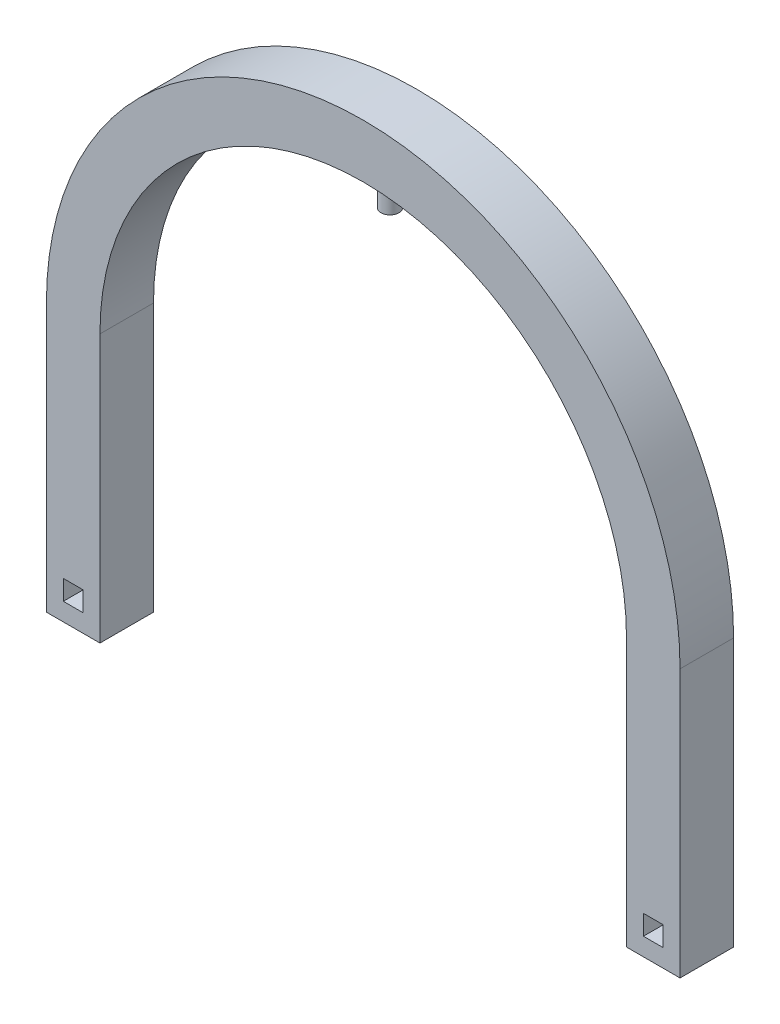
from build123d import *

# Parameters (mm, degrees)
SKETCH1_W                = 76.2
SKETCH1_H                = 76.2
BOSS_EXTRUDE1_DEPTH      = 381
BOSS_EXTRUDE1_2_DEPTH    = 381
CUT_EXTRUDE1_DEPTH       = 945.678553795
CUT_EXTRUDE1_DEPTH_BACK  = 945.678553795
SKETCH3_W                = 28.047256614
SKETCH3_H                = 28.245033948
BOSS_EXTRUDE2_DEPTH      = 38.1
BOSS_EXTRUDE2_DEPTH_BACK = 38.1
SKETCH5_R                = 12.7
BOSS_EXTRUDE3_DEPTH      = 50.8


with BuildPart() as part:
    # Sketch1 → Boss-Extrude1 (new body)
    with BuildSketch(Plane(origin=(0, 0, 0), x_dir=(1, 0, 0), z_dir=(0, 1, 0))):
        Rectangle(SKETCH1_W, SKETCH1_H)
    extrude(amount=BOSS_EXTRUDE1_DEPTH)


with BuildPart() as body_2:
    # Sketch1 → Boss-Extrude1 2 (new body)
    with BuildSketch(Plane(origin=(0, 0, 0), x_dir=(1, 0, 0), z_dir=(0, 1, 0))):
        with Locations((-825.5, 0)):
            Rectangle(SKETCH1_W, SKETCH1_H)
    extrude(amount=BOSS_EXTRUDE1_2_DEPTH)


with BuildPart() as cut_extrude1_tool:
    # Sketch3 → Cut-Extrude1 (new, two sides: drawn at the far end of the back side and taken through both)
    with BuildSketch(Plane.XY.offset(-CUT_EXTRUDE1_DEPTH_BACK)):
        with Locations((-825.5, 39.522516974)):
            Rectangle(SKETCH3_W, SKETCH3_H)
        with Locations((0, 39.522516974)):
            Rectangle(SKETCH3_W, SKETCH3_H)
    extrude(amount=CUT_EXTRUDE1_DEPTH + CUT_EXTRUDE1_DEPTH_BACK)


with BuildPart() as part_1:
    add(part.part)

    # Cut-Extrude1: cut by cut_extrude1_tool
    add(cut_extrude1_tool.part, mode=Mode.SUBTRACT)



with BuildPart() as body_2_1:
    add(body_2.part)

    # Cut-Extrude1: cut by cut_extrude1_tool
    add(cut_extrude1_tool.part, mode=Mode.SUBTRACT)


with BuildPart() as part_2:
    add(part_1.part)

    add(body_2_1.part)  # Boss-Extrude2 merges body 2
    # Sketch4 → Boss-Extrude2 (add, two sides: drawn at the far end of the back side and taken through both)
    with BuildSketch(Plane.XY.offset(-BOSS_EXTRUDE2_DEPTH_BACK)):
        with BuildLine():
            Line((-863.6, 381), (-787.4, 381))
            ThreePointArc((-787.4, 381), (-412.75, 755.65), (-38.1, 381))
            Line((-38.1, 381), (38.1, 381))
            ThreePointArc((38.1, 381), (-412.75, 831.85), (-863.6, 381))
        make_face()
    extrude(amount=BOSS_EXTRUDE2_DEPTH + BOSS_EXTRUDE2_DEPTH_BACK)

    # Sketch5 → Boss-Extrude3 (add)
    with BuildSketch(Plane(origin=(0, 755.65, 0), x_dir=(1, 0, 0), z_dir=(0, 1, 0))):
        with Locations(Location((-412.75, 0, 0), (0, 0, 270))):
            Circle(SKETCH5_R)
    extrude(amount=-BOSS_EXTRUDE3_DEPTH)


solid = part_2.part
